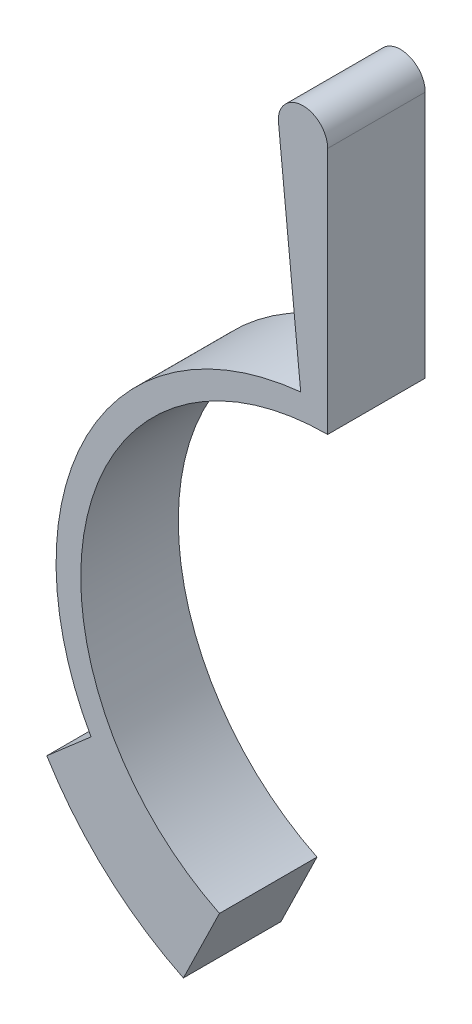
from build123d import *

# Parameters (mm, degrees)
RESSALTO_EXTRUS_O1_DEPTH = 11.849977


with BuildPart() as part:
    # Esboço1 → Ressalto-extrusão1 (new body)
    with BuildSketch(Plane.XY):
        with BuildLine():
            ThreePointArc((-10.685745363, -67.703603991), (-26.769323244, -33.991425444), (2.462180193, -10.738217779))
            Line((2.462180193, -10.738217779), (2.462180193, -0.672237217))
            Line((2.462180193, -0.672237217), (2.462180193, 19.360753065))
            ThreePointArc((2.462180193, 19.360753065), (-0.537819807, 22.360753065), (-3.537819807, 19.360753065))
            Line((-3.537819807, 19.360753065), (-3.478607435, 18.767652629))
            Line((-3.478607435, 18.767652629), (-0.816088481, -7.901455538))
            ThreePointArc((-0.816088481, -7.901455538), (-26.821074104, -25.523388901), (-26.291187743, -56.932162089))
            Line((-26.291187743, -56.932162089), (-31.663381791, -61.605561148))
            ThreePointArc((-31.663381791, -61.605561148), (-24.444874339, -70.335690922), (-15.068387215, -76.692066062))
            Line((-15.068387215, -76.692066062), (-10.685745363, -67.703603991))
        make_face()
    extrude(amount=RESSALTO_EXTRUS_O1_DEPTH)


solid = part.part
